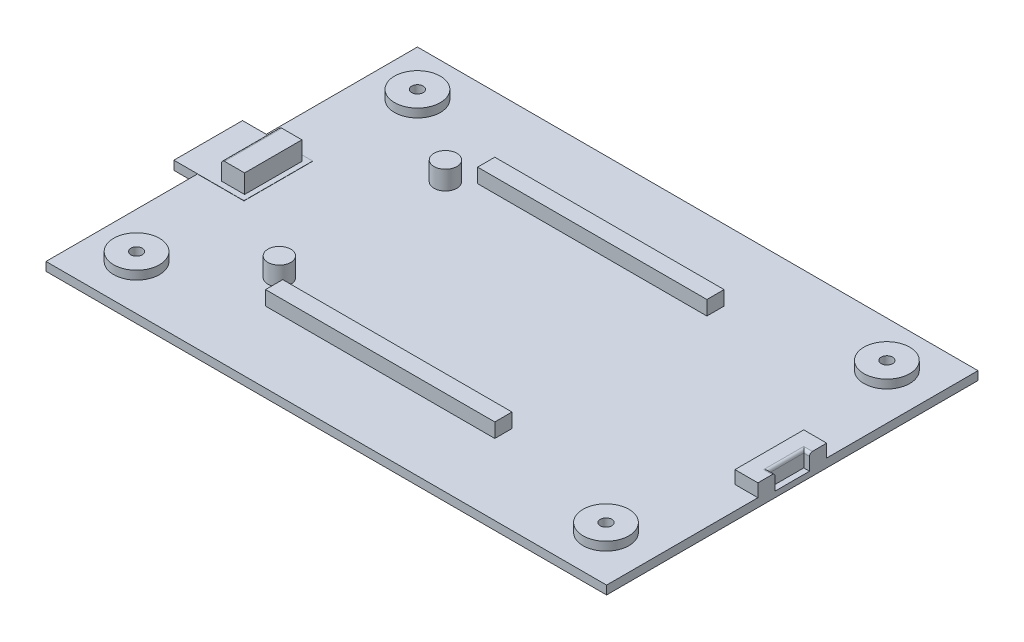
from build123d import *

# Parameters (mm, degrees)
EXTRUDE_1_DEPTH       = 1.5
SKETCH_2_R            = 6
CUT_EXTRUDE_1_DEPTH   = 0.1
SKETCH_11_R           = 2
SKETCH_11_W           = 12.230000073
SKETCH_11_H           = 11.974599949
EXTRUDE_5_DEPTH       = 1.539974634
SKETCH_13_R           = 2
SKETCH_13_W           = 4
SKETCH_13_H           = 10
TYPEC_2_DEPTH         = 4.7999746
LED_3_START           = -3.75
LED_3_DEPTH           = 2.25
LED_1_R               = 0.5
CUT_EXTRUDE_2_REACH   = 75.671
SKETCH_15_R           = 2
EXTRUDE_START         = -3
SKETCH_16_R           = 4
SKETCH_16_R_2         = 1
EXTRUDE_4_DEPTH       = 1.5
CUT_EXTRUDE_START     = -1.5
SKETCH_17_W           = 1
SKETCH_17_H           = 6
CUT_EXTRUDE_2_2_DEPTH = 0.5
SKETCH_18_W           = 40
SKETCH_18_H           = 3
EXTRUDE_2_DEPTH       = 2.5


with BuildPart() as part:
    # 草图1 → 凸台-拉伸1 (new body)
    with BuildSketch(Plane(origin=(0, 0, 0), x_dir=(1, 0, 0), z_dir=(0, 1, 0))):
        Polygon((-51.714401712, -9.454370264), (-55.816720774, -9.454370264), (-55.816720774, -21.428970213), (-51.714401712, -21.428970213), (-51.714401712, -47.841670238), (46.085598288, -47.841670238), (46.085598288, 16.958329762), (-51.714401712, 16.958329762), align=None)
    extrude(amount=EXTRUDE_1_DEPTH)

    # 草图2 → 切除-拉伸1 (cut)
    with BuildSketch(Plane.XZ):
        with Locations(Location((-43.814401712, -9.058329762, 0), (0, 0, 270))):
            Circle(SKETCH_2_R)
        with Locations(Location((-43.814401712, 39.941670238, 0), (0, 0, 270))):
            Circle(SKETCH_2_R)
        with Locations(Location((38.085598288, -9.058329762, 0), (0, 0, 270))):
            Circle(SKETCH_2_R)
        with Locations(Location((38.085598288, 39.941670238, 0), (0, 0, 270))):
            Circle(SKETCH_2_R)
    extrude(amount=-CUT_EXTRUDE_1_DEPTH, mode=Mode.SUBTRACT)

    # 草图11 → 充电板档板凸台-拉伸5 (add)
    with BuildSketch(Plane.XZ):
        with Locations((-28.914401712, 29.928970213)):
            Circle(SKETCH_11_R)
        with Locations((-28.914401712, 0.954370264)):
            Circle(SKETCH_11_R)
        with Locations((-49.701720738, 15.441670239)):
            Rectangle(SKETCH_11_W, SKETCH_11_H)
    extrude(amount=-EXTRUDE_5_DEPTH)

    # 草图13 → TypeC支撑凸台-拉伸2 (add)
    with BuildSketch(Plane.XZ):
        with Locations(Location((-28.914401712, 29.928970213, 0), (0, 0, 90))):
            Circle(SKETCH_13_R)
        with Locations(Location((-28.914401712, 0.954370264, 0), (0, 0, 90))):
            Circle(SKETCH_13_R)
        with Locations((-46.466720701, 15.441670238)):
            Rectangle(SKETCH_13_W, SKETCH_13_H)
    extrude(amount=-TYPEC_2_DEPTH)

    # 草图14 → LED限位凸台-拉伸3 (add)
    with BuildSketch(Plane.XZ.offset(LED_3_START)):
        Polygon((45.085598288, 12.441670238), (45.085598288, 18.441670238), (46.085598288, 18.441670238), (46.085598288, 21.441670238), (42.085598288, 21.441670238), (42.085598288, 9.441670238), (46.085598288, 9.441670238), (46.085598288, 12.441670238), align=None)
    extrude(amount=LED_3_DEPTH)

    # LED限位圆角1
    led_1_edges = [part.edges().sort_by_distance(p)[0] for p in [
        (45.585598288, 3.75, 18.441670238),
        (45.585598288, 3.75, 12.441670238),
        (45.085598288, 3.75, 15.441670238),
        (-48.466720701, 4.7999746, 15.441670238),
    ]]
    fillet(led_1_edges, radius=LED_1_R)

    # 草图15 → Cut-Extrude 2 (cut, up to next)
    with BuildSketch(Plane.XZ, mode=Mode.PRIVATE) as cut_extrude_2_sk1:
        with Locations(Location((-43.814401712, -9.058329762, 0), (0, 0, 270))):
            Circle(SKETCH_15_R)
    cut_extrude_2_tool1 = extrude(cut_extrude_2_sk1.sketch, amount=-CUT_EXTRUDE_2_REACH, mode=Mode.PRIVATE) & part.part
    # 草图15 → Cut-Extrude 2 (cut, up to next)
    with BuildSketch(Plane.XZ, mode=Mode.PRIVATE) as cut_extrude_2_sk2:
        with Locations(Location((-43.814401712, 39.941670238, 0), (0, 0, 270))):
            Circle(SKETCH_15_R)
    cut_extrude_2_tool2 = extrude(cut_extrude_2_sk2.sketch, amount=-CUT_EXTRUDE_2_REACH, mode=Mode.PRIVATE) & part.part
    # 草图15 → Cut-Extrude 2 (cut, up to next)
    with BuildSketch(Plane.XZ, mode=Mode.PRIVATE) as cut_extrude_2_sk3:
        with Locations(Location((38.085598288, 39.941670238, 0), (0, 0, 270))):
            Circle(SKETCH_15_R)
    cut_extrude_2_tool3 = extrude(cut_extrude_2_sk3.sketch, amount=-CUT_EXTRUDE_2_REACH, mode=Mode.PRIVATE) & part.part
    # 草图15 → Cut-Extrude 2 (cut, up to next)
    with BuildSketch(Plane.XZ, mode=Mode.PRIVATE) as cut_extrude_2_sk4:
        with Locations(Location((38.085598288, -9.058329762, 0), (0, 0, 270))):
            Circle(SKETCH_15_R)
    cut_extrude_2_tool4 = extrude(cut_extrude_2_sk4.sketch, amount=-CUT_EXTRUDE_2_REACH, mode=Mode.PRIVATE) & part.part
    add(cut_extrude_2_tool1.solids().sort_by_distance((-43.814402, 0, -9.05833))[0], mode=Mode.SUBTRACT)
    add(cut_extrude_2_tool2.solids().sort_by_distance((-43.814402, 0, 39.94167))[0], mode=Mode.SUBTRACT)
    add(cut_extrude_2_tool3.solids().sort_by_distance((38.085598, 0, 39.94167))[0], mode=Mode.SUBTRACT)
    add(cut_extrude_2_tool4.solids().sort_by_distance((38.085598, 0, -9.05833))[0], mode=Mode.SUBTRACT)

    # 草图16 → 螺丝孔凸台-拉伸4 (add)
    # profile 1 of 4: a face of its own
    with BuildSketch(Plane.XZ.offset(EXTRUDE_START)):
        with Locations((38.085598288, 39.941670238)):
            Circle(SKETCH_16_R)
        with Locations((38.085598288, 39.941670238)):
            Circle(SKETCH_16_R_2, mode=Mode.SUBTRACT)
    # profile 2 of 4: a face of its own
    with BuildSketch(Plane.XZ.offset(EXTRUDE_START)):
        with Locations((38.085598288, -9.058329762)):
            Circle(SKETCH_16_R)
        with Locations((38.085598288, -9.058329762)):
            Circle(SKETCH_16_R_2, mode=Mode.SUBTRACT)
    # profile 3 of 4: a face of its own
    with BuildSketch(Plane.XZ.offset(EXTRUDE_START)):
        with Locations((-43.814401712, -9.058329762)):
            Circle(SKETCH_16_R)
        with Locations((-43.814401712, -9.058329762)):
            Circle(SKETCH_16_R_2, mode=Mode.SUBTRACT)
    # profile 4 of 4: a face of its own
    with BuildSketch(Plane.XZ.offset(EXTRUDE_START)):
        with Locations((-43.814401712, 39.941670238)):
            Circle(SKETCH_16_R)
        with Locations((-43.814401712, 39.941670238)):
            Circle(SKETCH_16_R_2, mode=Mode.SUBTRACT)
    extrude(amount=EXTRUDE_4_DEPTH)

    # 草图17 → Cut-Extrude 2 2 (cut)
    with BuildSketch(Plane.XZ.offset(CUT_EXTRUDE_START)):
        with Locations((45.585598288, 15.441670238)):
            Rectangle(SKETCH_17_W, SKETCH_17_H)
    extrude(amount=CUT_EXTRUDE_2_2_DEPTH, mode=Mode.SUBTRACT)

    # 草图18 → 凸台-拉伸2 (add)
    with BuildSketch(Plane(origin=(0, 1.5, 0), x_dir=(1, 0, 0), z_dir=(0, 1, 0))):
        with Locations((-5.814401712, 3.058329762)):
            Rectangle(SKETCH_18_W, SKETCH_18_H)
        with Locations((-5.814401712, -33.941670238)):
            Rectangle(SKETCH_18_W, SKETCH_18_H)
    extrude(amount=EXTRUDE_2_DEPTH)


solid = part.part
